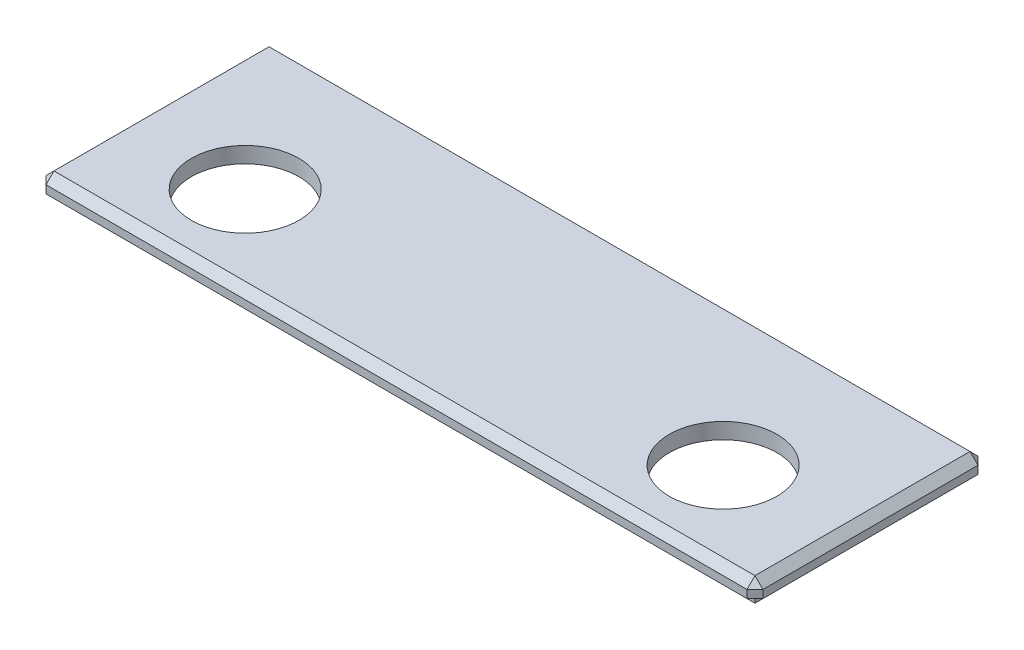
from build123d import *

# Parameters (mm, degrees)
SKETCH1_W           = 90
SKETCH1_H           = 29
BOSS_EXTRUDE1_DEPTH = 2
CHAMFER1_SIZE       = 1
SKETCH2_R           = 6.75
CUT_EXTRUDE1_DEPTH  = 48.32071428
SKETCH3_W           = 86
SKETCH3_H           = 25
SKETCH3_W_2         = 82
SKETCH3_H_2         = 21
BOSS_EXTRUDE2_DEPTH = 2


with BuildPart() as part:
    # Sketch1 → Boss-Extrude1 (new body)
    with BuildSketch(Plane(origin=(0, 0, 0), x_dir=(1, 0, 0), z_dir=(0, 1, 0))):
        Rectangle(SKETCH1_W, SKETCH1_H)
    extrude(amount=BOSS_EXTRUDE1_DEPTH)

    # Chamfer1
    chamfer1_edges = [part.edges().sort_by_distance(p)[0] for p in [
        (-45, 2, 0),
        (0, 2, 14.5),
        (45, 2, 0),
        (45, 1, 14.5),
        (-45, 1, 14.5),
        (-45, 1, -14.5),
        (45, 1, -14.5),
        (0, 2, -14.5),
    ]]
    chamfer(chamfer1_edges, length=CHAMFER1_SIZE)

    # Sketch2 → Cut-Extrude1 (cut, through all)
    with BuildSketch(Plane(origin=(0, 2, 0), x_dir=(1, 0, 0), z_dir=(0, 1, 0))):
        with Locations(Location((-30, -3.5, 0), (0, 0, 270))):
            Circle(SKETCH2_R)
        with Locations(Location((30, -3.5, 0), (0, 0, 270))):
            Circle(SKETCH2_R)
    extrude(amount=-CUT_EXTRUDE1_DEPTH, mode=Mode.SUBTRACT)

    # Sketch3 → Boss-Extrude2 (add)
    with BuildSketch(Plane.XZ):
        Rectangle(SKETCH3_W, SKETCH3_H)
        Rectangle(SKETCH3_W_2, SKETCH3_H_2, mode=Mode.SUBTRACT)
    extrude(amount=BOSS_EXTRUDE2_DEPTH)


solid = part.part
